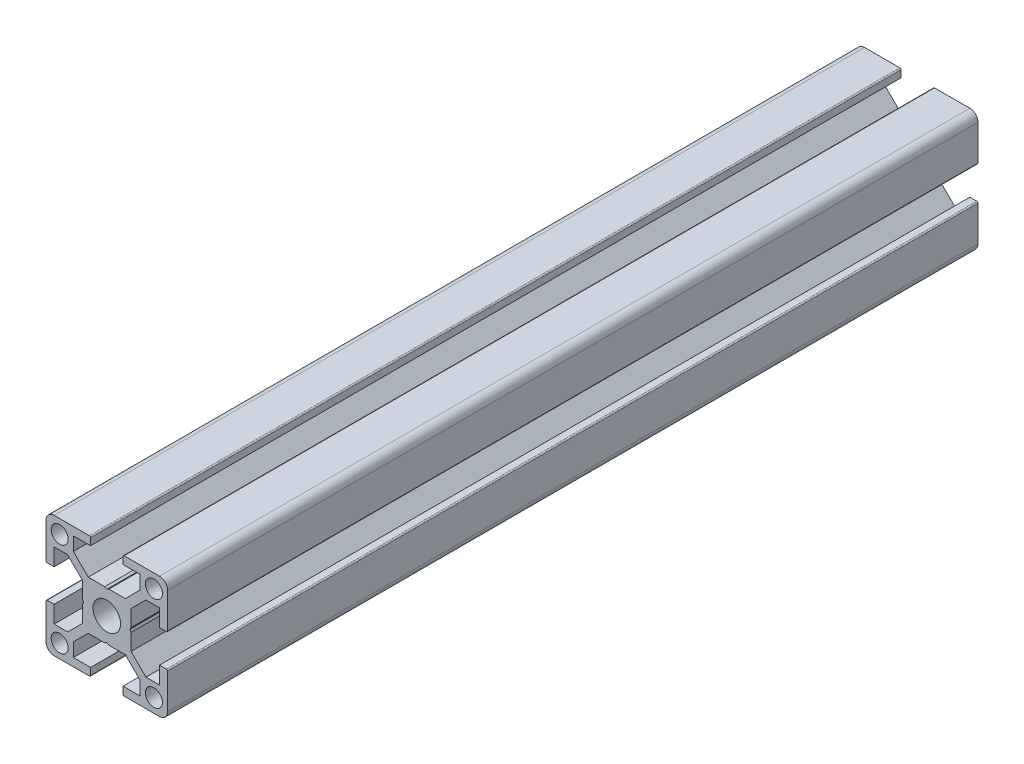
from build123d import *

# Parameters (mm, degrees)
SKETCH1_R           = 2.1
SKETCH1_R_2         = 3.4
BOSS_EXTRUDE1_DEPTH = 200


with BuildPart() as part:
    # Sketch1 → Boss-Extrude1 (new body)
    with BuildSketch(Plane.XY):
        with BuildLine():
            Line((-14.7, 4), (-13, 4))
            Line((-13, 4), (-13, 8.25))
            Line((-13, 8.25), (-9.664213562, 8.25))
            Line((-9.664213562, 8.25), (-6, 4.585786438))
            Line((-6, 4.585786438), (-6, 0.519615242))
            Line((-6, 0.519615242), (-5.7, 0))
            Line((-5.7, 0), (-6, -0.519615242))
            Line((-6, -0.519615242), (-6, -4.585786438))
            Line((-6, -4.585786438), (-9.664213562, -8.25))
            Line((-9.664213562, -8.25), (-13, -8.25))
            Line((-13, -8.25), (-13, -4))
            Line((-13, -4), (-14.7, -4))
            ThreePointArc((-14.7, -4), (-14.912132034, -4.087867966), (-15, -4.3))
            Line((-15, -4.3), (-15, -13))
            ThreePointArc((-15, -13), (-14.414213562, -14.414213562), (-13, -15))
            Line((-13, -15), (-4.3, -15))
            ThreePointArc((-4.3, -15), (-4.087867966, -14.912132034), (-4, -14.7))
            Line((-4, -14.7), (-4, -13))
            Line((-4, -13), (-8.25, -13))
            Line((-8.25, -13), (-8.25, -9.664213562))
            Line((-8.25, -9.664213562), (-4.585786438, -6))
            Line((-4.585786438, -6), (-0.519615242, -6))
            Line((-0.519615242, -6), (0, -5.7))
            Line((0, -5.7), (0.519615242, -6))
            Line((0.519615242, -6), (4.585786438, -6))
            Line((4.585786438, -6), (8.25, -9.664213562))
            Line((8.25, -9.664213562), (8.25, -13))
            Line((8.25, -13), (4, -13))
            Line((4, -13), (4, -14.7))
            ThreePointArc((4, -14.7), (4.087867966, -14.912132034), (4.3, -15))
            Line((4.3, -15), (13, -15))
            ThreePointArc((13, -15), (14.414213562, -14.414213562), (15, -13))
            Line((15, -13), (15, -4.3))
            ThreePointArc((15, -4.3), (14.912132034, -4.087867966), (14.7, -4))
            Line((14.7, -4), (13, -4))
            Line((13, -4), (13, -8.25))
            Line((13, -8.25), (9.664213562, -8.25))
            Line((9.664213562, -8.25), (6, -4.585786438))
            Line((6, -4.585786438), (6, -0.519615242))
            Line((6, -0.519615242), (5.7, 0))
            Line((5.7, 0), (6, 0.519615242))
            Line((6, 0.519615242), (6, 4.585786438))
            Line((6, 4.585786438), (9.664213562, 8.25))
            Line((9.664213562, 8.25), (13, 8.25))
            Line((13, 8.25), (13, 4))
            Line((13, 4), (14.7, 4))
            ThreePointArc((14.7, 4), (14.912132034, 4.087867966), (15, 4.3))
            Line((15, 4.3), (15, 13))
            ThreePointArc((15, 13), (14.414213562, 14.414213562), (13, 15))
            Line((13, 15), (4.3, 15))
            ThreePointArc((4.3, 15), (4.087867966, 14.912132034), (4, 14.7))
            Line((4, 14.7), (4, 13))
            Line((4, 13), (8.25, 13))
            Line((8.25, 13), (8.25, 9.664213562))
            Line((8.25, 9.664213562), (4.585786438, 6))
            Line((4.585786438, 6), (0.519615242, 6))
            Line((0.519615242, 6), (0, 5.7))
            Line((0, 5.7), (-0.519615242, 6))
            Line((-0.519615242, 6), (-4.585786438, 6))
            Line((-4.585786438, 6), (-8.25, 9.664213562))
            Line((-8.25, 9.664213562), (-8.25, 13))
            Line((-8.25, 13), (-4, 13))
            Line((-4, 13), (-4, 14.7))
            ThreePointArc((-4, 14.7), (-4.087867966, 14.912132034), (-4.3, 15))
            Line((-4.3, 15), (-13, 15))
            ThreePointArc((-13, 15), (-14.414213562, 14.414213562), (-15, 13))
            Line((-15, 13), (-15, 4.3))
            ThreePointArc((-15, 4.3), (-14.912132034, 4.087867966), (-14.7, 4))
        make_face()
        with Locations((11.625, 11.625)):
            Circle(SKETCH1_R, mode=Mode.SUBTRACT)
        with Locations((11.625, -11.625)):
            Circle(SKETCH1_R, mode=Mode.SUBTRACT)
        Circle(SKETCH1_R_2, mode=Mode.SUBTRACT)
        with Locations((-11.625, -11.625)):
            Circle(SKETCH1_R, mode=Mode.SUBTRACT)
        with Locations((-11.625, 11.625)):
            Circle(SKETCH1_R, mode=Mode.SUBTRACT)
    extrude(amount=BOSS_EXTRUDE1_DEPTH)


solid = part.part
